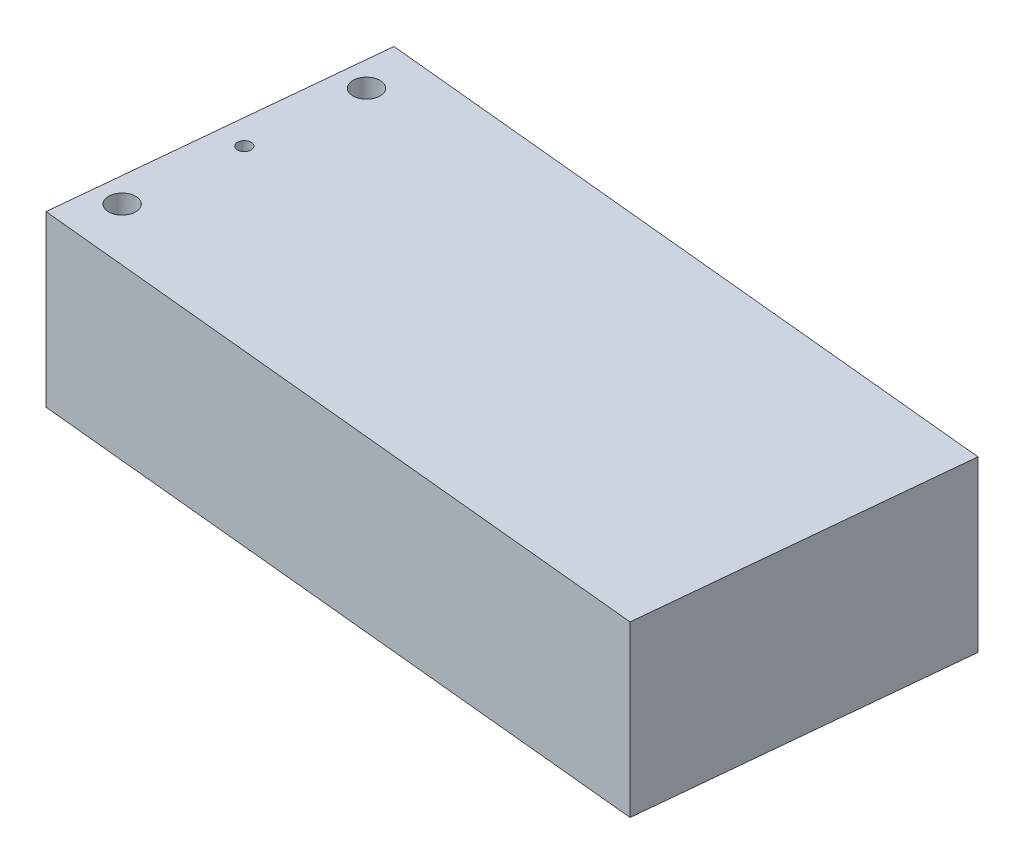
from build123d import *

# Parameters (mm, degrees)
SKETCH_1_R      = 2
SKETCH_1_R_2    = 1
EXTRUDE_1_DEPTH = 25


with BuildPart() as part:
    # Эскиз1 → Бобышка-Вытянуть1 (new body)
    with BuildSketch(Plane(origin=(0, 0, 0), x_dir=(1, 0, 0), z_dir=(0, 1, 0))):
        Polygon((0, 0), (95.543981023, -9.345998627), (100.119626184, 37.430742082), (4.575645161, 46.776740709), align=None)
        with Locations(Location((4.662478276, 6.577332007, 0), (0, 0, 270))):
            Circle(SKETCH_1_R, mode=Mode.SUBTRACT)
        with Locations(Location((7.875165304, 39.420575483, 0), (0, 0, 270))):
            Circle(SKETCH_1_R, mode=Mode.SUBTRACT)
        with Locations(Location((6.26882179, 22.998953745, 0), (0, 0, 270))):
            Circle(SKETCH_1_R_2, mode=Mode.SUBTRACT)
    extrude(amount=EXTRUDE_1_DEPTH)


solid = part.part
